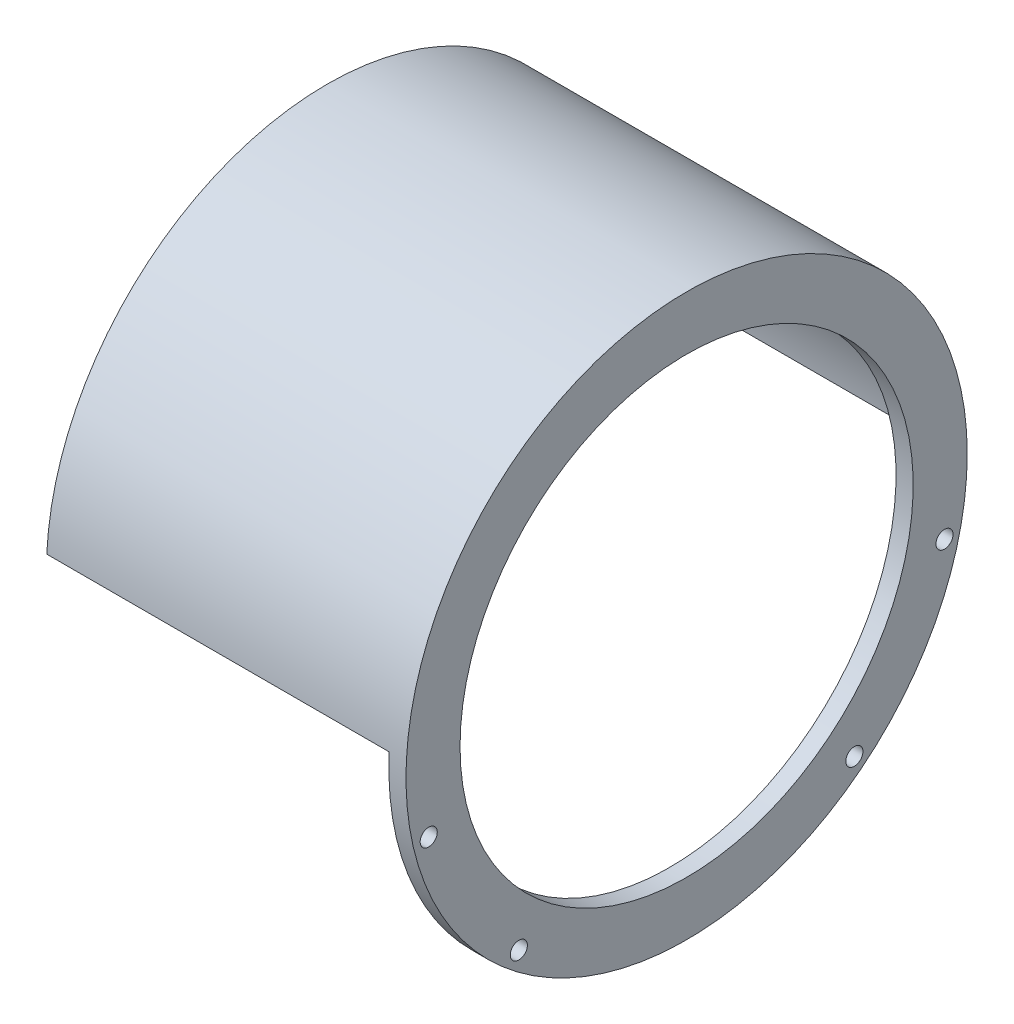
from build123d import *
from build123d.topology import SkipClean

# Parameters (mm, degrees)
SKETCH_1_R      = 49.171750004
SKETCH_1_R_2    = 39.7
EXTRUDE_1_DEPTH = 3
EXTRUDE_START   = 60
EXTRUDE_2_DEPTH = 60
SKETCH_3_R      = 1.5
EXTRUDE_4_DEPTH = 60
EXTRUDE_5_DEPTH = 2
SKETCH_5_R      = 1.5
EXTRUDE_6_DEPTH = 10


with BuildPart() as part:
    # Эскиз1 → Выдавливание1 (new body)
    with BuildSketch(Plane.YZ):
        with Locations(Location((37.5, 47.7, 0), (0, 0, 90))):
            Circle(SKETCH_1_R)
        with Locations(Location((37.5, 47.7, 0), (0, 0, 90))):
            Circle(SKETCH_1_R_2, mode=Mode.SUBTRACT)
    extrude(amount=EXTRUDE_1_DEPTH)

    # Эскиз2 → Выдавливание2 (add)
    with BuildSketch(Plane(origin=(0, 37.5, 47.7), x_dir=(0, 0, 1), z_dir=(-1, 0, 0)).offset(EXTRUDE_START)):
        with BuildLine():
            ThreePointArc((-42.287817796, 5.918654073), (-45.733949258, 4.2292184), (-49.112714544, 2.408789856))
            ThreePointArc((-49.112714544, 2.408789856), (0, 49.171750004), (49.112714544, 2.408789856))
            ThreePointArc((49.112714544, 2.408789856), (45.733949258, 4.2292184), (42.287817796, 5.918654073))
            ThreePointArc((42.287817796, 5.918654073), (0, 42.7), (-42.287817796, 5.918654073))
        make_face()
    extrude(amount=-EXTRUDE_2_DEPTH)

    # Эскиз3 → Выдавливание4 (cut)
    with BuildSketch(Plane(origin=(3, 37.5, 47.7), x_dir=(0, 0, -1), z_dir=(1, 0, 0))):
        with Locations((45.186031447, -10.975999366)):
            Circle(SKETCH_3_R)
        with Locations((29.39321752, -36.031774364)):
            Circle(SKETCH_3_R)
        with Locations((-29.39321752, -36.031774364)):
            Circle(SKETCH_3_R)
        with Locations((-45.186031447, -10.975999366)):
            Circle(SKETCH_3_R)
    extrude(amount=-EXTRUDE_4_DEPTH, mode=Mode.SUBTRACT)

    # Эскиз4 → Выдавливание5 (add)
    with SkipClean():  # the faces are left unmerged after this step: merging them gives an invalid solid
        with BuildSketch(Plane(origin=(-60, 37.5, 47.7), x_dir=(0, 0, 1), z_dir=(-1, 0, 0))):
            with BuildLine():
                Line((-0.24997743, 16.30888643), (0.499998469, 16.307958241))
                Line((0.499998469, 16.307958241), (0, 16.309195752))
                ThreePointArc((0, 16.309195752), (-0.124988811, 16.309118421), (-0.24997743, 16.30888643))
            make_face()
            with BuildLine():
                ThreePointArc((-42.287817796, 5.918654073), (0, 15.3), (42.287817796, 5.918654073))
                Line((42.287817796, 5.918654073), (42.121404236, 7.107651815))
                ThreePointArc((42.121404236, 7.107651815), (21.801545856, 13.928343922), (0.499998469, 16.307958241))
                Line((0.499998469, 16.307958241), (-0.24997743, 16.30888643))
                ThreePointArc((-0.24997743, 16.30888643), (-21.679464377, 13.955250498), (-42.121404236, 7.107651815))
                Line((-42.121404236, 7.107651815), (-42.287817796, 5.918654073))
            make_face()
            with BuildLine():
                Line((0, 16.309195752), (0.499998469, 16.307958241))
                ThreePointArc((0.499998469, 16.307958241), (0.25, 16.308886374), (0, 16.309195752))
            make_face()
        extrude(amount=-EXTRUDE_5_DEPTH)

    # Эскиз5 → Резьба6 (cut)
    with SkipClean():  # the faces are left unmerged after this step: merging them gives an invalid solid
        with BuildSketch(Plane(origin=(1.5, 35.097404478, 62.473935176), x_dir=(0, 0, -1), z_dir=(0, 1, 0))):
            with Locations((-31.126064824, 51.234)):
                Circle(SKETCH_5_R)
            with Locations((-31.126064824, 32.434)):
                Circle(SKETCH_5_R)
            with Locations((-31.126064824, 14.694)):
                Circle(SKETCH_5_R)
            with Locations((60.673935176, 51.234)):
                Circle(SKETCH_5_R)
            with Locations((60.673935176, 32.434)):
                Circle(SKETCH_5_R)
            with Locations((60.673935176, 14.694)):
                Circle(SKETCH_5_R)
        extrude(amount=EXTRUDE_6_DEPTH, mode=Mode.SUBTRACT)


solid = part.part
